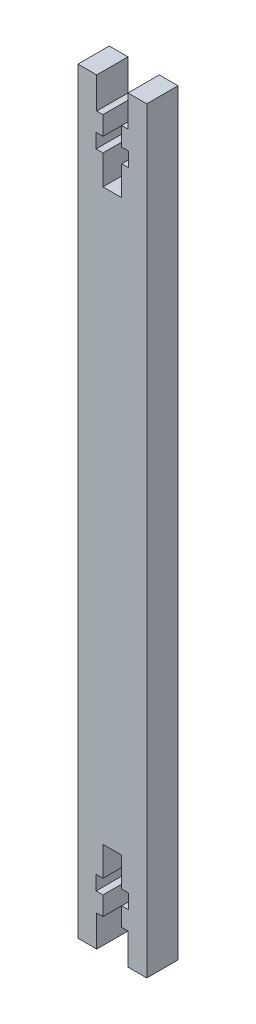
from build123d import *

# Parameters (mm, degrees)
BOSS_EXTRUDE1_DEPTH = 5


with BuildPart() as part:
    # Sketch1 → Boss-Extrude1 (new body)
    with BuildSketch(Plane.XY):
        Polygon((-9, 116), (-9, 5), (-9, 0), (-12, 0), (-12, 5), (-13, 5), (-13, 8), (-11.9, 8), (-11.9, 10.3), (-13, 10.3), (-13, 15), (-16, 15), (-16, 10.3), (-17.1, 10.3), (-17.1, 8), (-16, 8), (-16, 5), (-17, 5), (-17, 0), (-20, 0), (-20, 5), (-20, 116), (-20, 121), (-17, 121), (-17, 116), (-16, 116), (-16, 113), (-17.1, 113), (-17.1, 110.7), (-16, 110.7), (-16, 106), (-13, 106), (-13, 110.7), (-11.9, 110.7), (-11.9, 113), (-13, 113), (-13, 116), (-12, 116), (-12, 121), (-9, 121), align=None)
    extrude(amount=BOSS_EXTRUDE1_DEPTH)


solid = part.part
